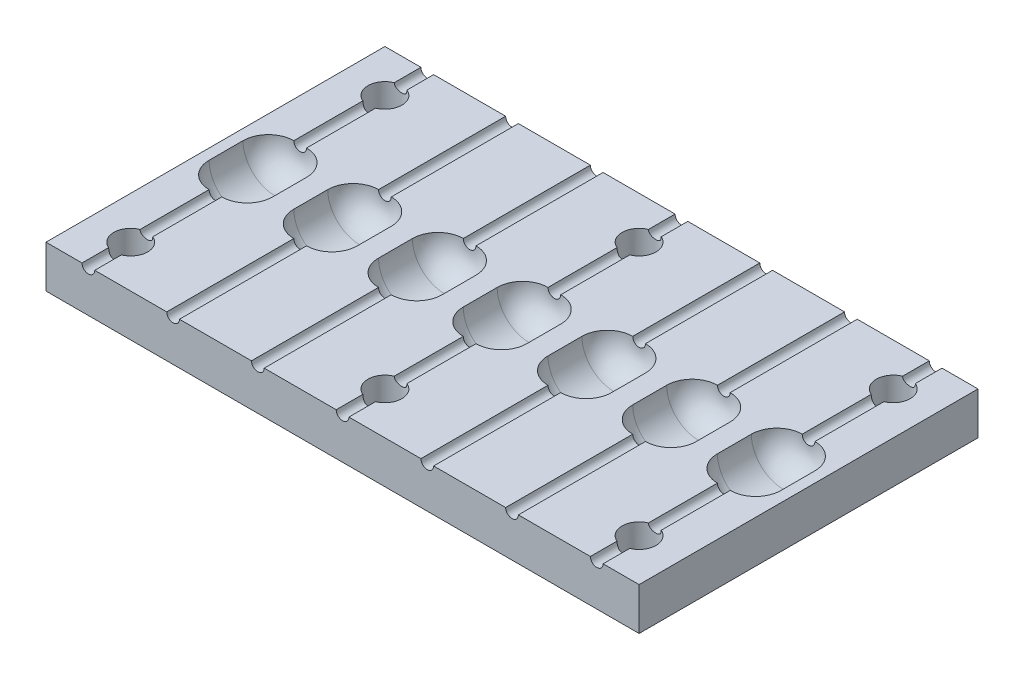
from build123d import *

# Parameters (mm, degrees)
ESQUISSE1_W                  = 70
ESQUISSE1_H                  = 40
BOSS_EXTRU_1_DEPTH           = 5
ENL_V_MAT_EXTRU_1_DEPTH      = 5
ENL_V_MAT_EXTRU_1_DEPTH_BACK = 5
ENL_V_MAT_EXTRU_3_REACH      = 56.083
ESQUISSE4_R                  = 2
CONG_1_R                     = 3
ESQUISSE5_W                  = 0.75
ESQUISSE5_H                  = 40
R_P_TITION_LIN_AIRE1_COUNT   = 7
R_P_TITION_LIN_AIRE1_PITCH   = 10


with BuildPart() as part:
    # Esquisse1 → Boss.-Extru.1 (new body)
    with BuildSketch(Plane(origin=(0, 0, 0), x_dir=(1, 0, 0), z_dir=(0, 1, 0))):
        with Locations((-15, 0)):
            Rectangle(ESQUISSE1_W, ESQUISSE1_H)
    extrude(amount=BOSS_EXTRU_1_DEPTH)

    # Esquisse2 → Enlèv. mat.-Extru.1 (cut, two sides: drawn at the far end of the back side and taken through both)
    with BuildSketch(Plane.XY.offset(-ENL_V_MAT_EXTRU_1_DEPTH_BACK)):
        with BuildLine():
            Line((-38.75, 5), (-31.25, 5))
            ThreePointArc((-31.25, 5), (-35, 1.25), (-38.75, 5))
        make_face()
        with BuildLine():
            Line((-48.75, 5), (-41.25, 5))
            ThreePointArc((-41.25, 5), (-45, 1.25), (-48.75, 5))
        make_face()
        with BuildLine():
            Line((-28.75, 5), (-21.25, 5))
            ThreePointArc((-21.25, 5), (-25, 1.25), (-28.75, 5))
        make_face()
        with BuildLine():
            Line((-18.75, 5), (-11.25, 5))
            ThreePointArc((-11.25, 5), (-15, 1.25), (-18.75, 5))
        make_face()
        with BuildLine():
            Line((-8.75, 5), (-1.25, 5))
            ThreePointArc((-1.25, 5), (-5, 1.25), (-8.75, 5))
        make_face()
        with BuildLine():
            Line((1.25, 5), (8.75, 5))
            ThreePointArc((8.75, 5), (5, 1.25), (1.25, 5))
        make_face()
        with BuildLine():
            Line((11.25, 5), (18.75, 5))
            ThreePointArc((18.75, 5), (15, 1.25), (11.25, 5))
        make_face()
    extrude(amount=ENL_V_MAT_EXTRU_1_DEPTH + ENL_V_MAT_EXTRU_1_DEPTH_BACK, mode=Mode.SUBTRACT)

    # Esquisse4 → Enlèv. mat.-Extru.3 (cut, up to next)
    with BuildSketch(Plane(origin=(0, 5, 0), x_dir=(1, 0, 0), z_dir=(0, 1, 0)), mode=Mode.PRIVATE) as enl_v_mat_extru_3_sk1:
        with Locations(Location((-45, -15, 0), (0, 0, 270))):
            Circle(ESQUISSE4_R)
    enl_v_mat_extru_3_tool1 = extrude(enl_v_mat_extru_3_sk1.sketch, amount=-ENL_V_MAT_EXTRU_3_REACH, mode=Mode.PRIVATE) & part.part
    # Esquisse4 → Enlèv. mat.-Extru.3 (cut, up to next)
    with BuildSketch(Plane(origin=(0, 5, 0), x_dir=(1, 0, 0), z_dir=(0, 1, 0)), mode=Mode.PRIVATE) as enl_v_mat_extru_3_sk2:
        with Locations(Location((-45, 15, 0), (0, 0, 270))):
            Circle(ESQUISSE4_R)
    enl_v_mat_extru_3_tool2 = extrude(enl_v_mat_extru_3_sk2.sketch, amount=-ENL_V_MAT_EXTRU_3_REACH, mode=Mode.PRIVATE) & part.part
    # Esquisse4 → Enlèv. mat.-Extru.3 (cut, up to next)
    with BuildSketch(Plane(origin=(0, 5, 0), x_dir=(1, 0, 0), z_dir=(0, 1, 0)), mode=Mode.PRIVATE) as enl_v_mat_extru_3_sk3:
        with Locations(Location((15, 15, 0), (0, 0, 270))):
            Circle(ESQUISSE4_R)
    enl_v_mat_extru_3_tool3 = extrude(enl_v_mat_extru_3_sk3.sketch, amount=-ENL_V_MAT_EXTRU_3_REACH, mode=Mode.PRIVATE) & part.part
    # Esquisse4 → Enlèv. mat.-Extru.3 (cut, up to next)
    with BuildSketch(Plane(origin=(0, 5, 0), x_dir=(1, 0, 0), z_dir=(0, 1, 0)), mode=Mode.PRIVATE) as enl_v_mat_extru_3_sk4:
        with Locations(Location((15, -15, 0), (0, 0, 270))):
            Circle(ESQUISSE4_R)
    enl_v_mat_extru_3_tool4 = extrude(enl_v_mat_extru_3_sk4.sketch, amount=-ENL_V_MAT_EXTRU_3_REACH, mode=Mode.PRIVATE) & part.part
    # Esquisse4 → Enlèv. mat.-Extru.3 (cut, up to next)
    with BuildSketch(Plane(origin=(0, 5, 0), x_dir=(1, 0, 0), z_dir=(0, 1, 0)), mode=Mode.PRIVATE) as enl_v_mat_extru_3_sk5:
        with Locations(Location((-15, 15, 0), (0, 0, 270))):
            Circle(ESQUISSE4_R)
    enl_v_mat_extru_3_tool5 = extrude(enl_v_mat_extru_3_sk5.sketch, amount=-ENL_V_MAT_EXTRU_3_REACH, mode=Mode.PRIVATE) & part.part
    # Esquisse4 → Enlèv. mat.-Extru.3 (cut, up to next)
    with BuildSketch(Plane(origin=(0, 5, 0), x_dir=(1, 0, 0), z_dir=(0, 1, 0)), mode=Mode.PRIVATE) as enl_v_mat_extru_3_sk6:
        with Locations(Location((-15, -15, 0), (0, 0, 270))):
            Circle(ESQUISSE4_R)
    enl_v_mat_extru_3_tool6 = extrude(enl_v_mat_extru_3_sk6.sketch, amount=-ENL_V_MAT_EXTRU_3_REACH, mode=Mode.PRIVATE) & part.part
    add(enl_v_mat_extru_3_tool1.solids().sort_by_distance((-45, 5, 15))[0], mode=Mode.SUBTRACT)
    add(enl_v_mat_extru_3_tool2.solids().sort_by_distance((-45, 5, -15))[0], mode=Mode.SUBTRACT)
    add(enl_v_mat_extru_3_tool3.solids().sort_by_distance((15, 5, -15))[0], mode=Mode.SUBTRACT)
    add(enl_v_mat_extru_3_tool4.solids().sort_by_distance((15, 5, 15))[0], mode=Mode.SUBTRACT)
    add(enl_v_mat_extru_3_tool5.solids().sort_by_distance((-15, 5, -15))[0], mode=Mode.SUBTRACT)
    add(enl_v_mat_extru_3_tool6.solids().sort_by_distance((-15, 5, 15))[0], mode=Mode.SUBTRACT)

    # Congé1
    cong_1_edges = [part.edges().sort_by_distance(p)[0] for p in [
        (-35, 1.25, -5),
        (-35, 1.25, 5),
        (-25, 1.25, -5),
        (-25, 1.25, 5),
        (-15, 1.25, -5),
        (-15, 1.25, 5),
        (-5, 1.25, -5),
        (-5, 1.25, 5),
        (5, 1.25, -5),
        (5, 1.25, 5),
        (15, 1.25, -5),
        (15, 1.25, 5),
        (-45, 1.25, -5),
        (-45, 1.25, 5),
    ]]
    fillet(cong_1_edges, radius=CONG_1_R)

    # Esquisse5 → Enlèvement de matière-Révolution1 (revolve, cut)
    with BuildSketch(Plane(origin=(0, 5, 0), x_dir=(1, 0, 0), z_dir=(0, 1, 0))):
        with Locations((-45.375, 0)):
            Rectangle(ESQUISSE5_W, ESQUISSE5_H)
    enl_vement_de_mati_re_r_volution1 = revolve(axis=Axis((-45, 5, -27.063370243), (0, 0, 1)), mode=Mode.SUBTRACT)

    # Répétition linéaire1: Enlèvement de matière-Révolution1 ×7
    with Locations(*[(i * R_P_TITION_LIN_AIRE1_PITCH, 0, 0) for i in range(1, R_P_TITION_LIN_AIRE1_COUNT)]):
        add(enl_vement_de_mati_re_r_volution1, mode=Mode.SUBTRACT)


solid = part.part
